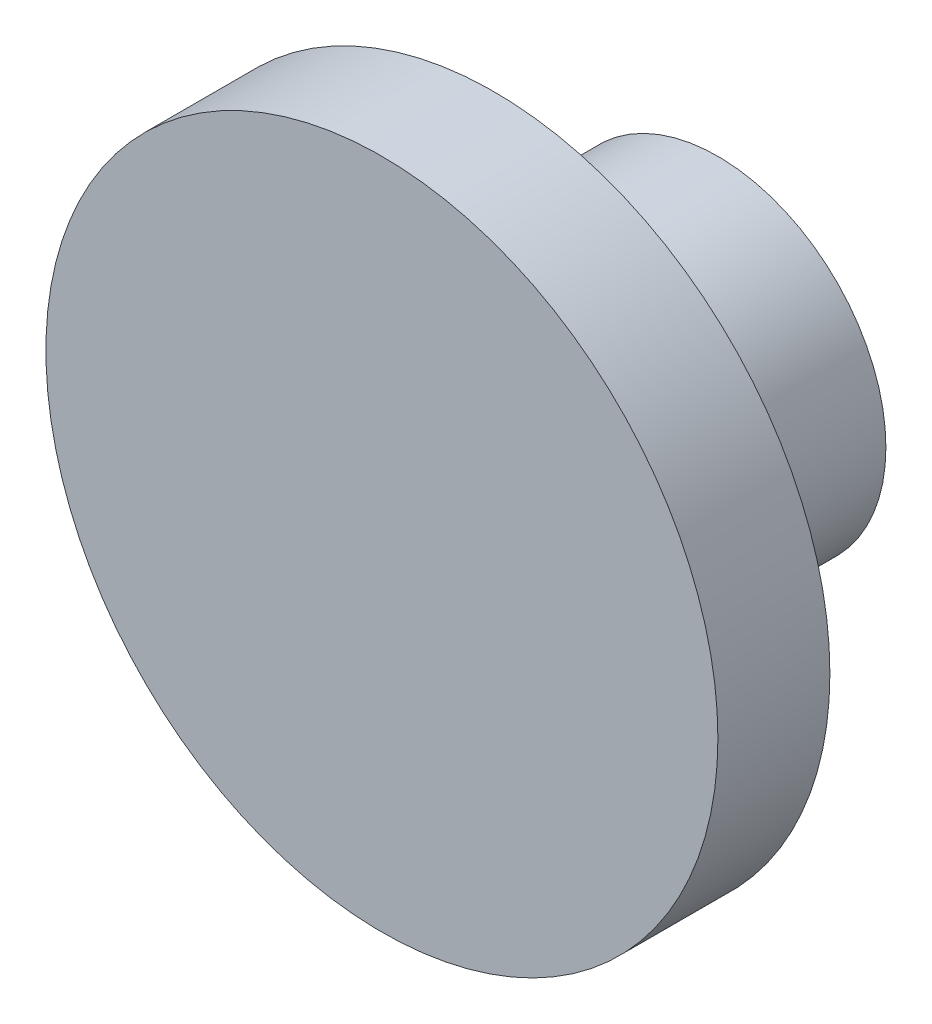
from build123d import *

# Parameters (mm, degrees)
SKETCH1_R           = 7.5
BOSS_EXTRUDE1_DEPTH = 10
SKETCH2_R           = 15
BOSS_EXTRUDE2_DEPTH = 5
SKETCH3_R           = 2.5
CUT_EXTRUDE1_DEPTH  = 5


with BuildPart() as part:
    # Sketch1 → Boss-Extrude1 (new body)
    with BuildSketch(Plane.XY):
        Circle(SKETCH1_R)
    extrude(amount=BOSS_EXTRUDE1_DEPTH)

    # Sketch2 → Boss-Extrude2 (add)
    with BuildSketch(Plane.XY.offset(10)):
        Circle(SKETCH2_R)
    extrude(amount=BOSS_EXTRUDE2_DEPTH)

    # Sketch3 → Cut-Extrude1 (cut)
    with BuildSketch(Plane(origin=(0, 0, 0), x_dir=(-1, 0, 0), z_dir=(0, 0, -1))):
        Circle(SKETCH3_R)
    extrude(amount=-CUT_EXTRUDE1_DEPTH, mode=Mode.SUBTRACT)


solid = part.part
